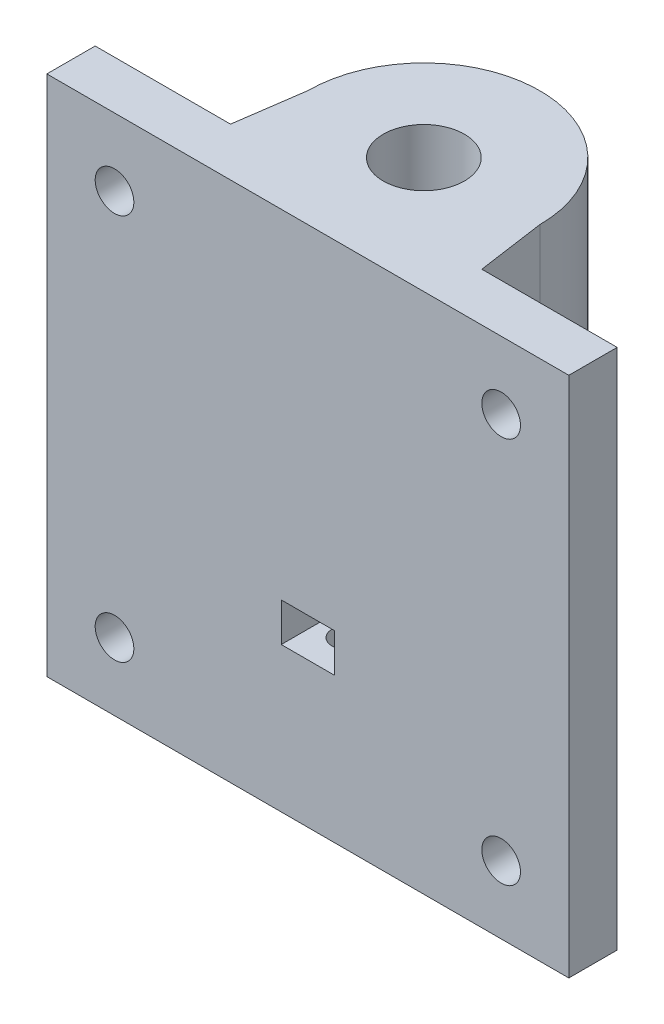
from build123d import *

# Parameters (mm, degrees)
SZKIC1_R                    = 12
SZKIC1_R_2                  = 4.2
DODANIE_WYCI_GNI_CIE1_DEPTH = 54
DODANIE_WYCI_GNI_CIE2_DEPTH = 54
SZKIC4_R                    = 1.5
WYTNIJ_WYCI_GNI_CIE1_DEPTH  = 20
SZYK_KO_OWY1_COUNT          = 4
WYTNIJ_WYCI_GNI_CIE2_START  = -7
SZKIC5_W                    = 5.5
SZKIC5_H                    = 4
WYTNIJ_WYCI_GNI_CIE2_DEPTH  = 10
SZYK_KO_OWY2_COUNT          = 4
SFAZOWANIE1_SIZE            = 1
SFAZOWANIE1_SIZE2           = 0.839099631
WYTNIJ_WYCI_GNI_CIE3_REACH  = 66.969
SZKIC6_R                    = 2


with BuildPart() as part:
    # Szkic1 → Dodanie-wyciągnięcie1 (new body)
    with BuildSketch(Plane(origin=(0, 0, 0), x_dir=(1, 0, 0), z_dir=(0, 1, 0))):
        with Locations(Location((0, 12, 0), (0, 0, 270))):
            Circle(SZKIC1_R)
        with Locations(Location((0, 12, 0), (0, 0, 270))):
            Circle(SZKIC1_R_2, mode=Mode.SUBTRACT)
    extrude(amount=DODANIE_WYCI_GNI_CIE1_DEPTH)

    # Szkic3 → Dodanie-wyciągnięcie2 (add)
    with BuildSketch(Plane(origin=(0, 0, 0), x_dir=(1, 0, 0), z_dir=(0, 1, 0))):
        Polygon((0, 0), (27, 0), (27, 5), (13, 5), (12, 12), (0, 5.166487606), (-12, 12), (-13, 5), (-27, 5), (-27, 0), align=None)
    extrude(amount=DODANIE_WYCI_GNI_CIE2_DEPTH)

    # Szkic4 → Wytnij-wyciągnięcie1 (cut)
    with BuildSketch(Plane(origin=(0, 0, 0), x_dir=(-1, 0, 0), z_dir=(0, -1, 0))):
        with Locations(Location((0, 20, 0), (0, 0, 90))):
            Circle(SZKIC4_R)
    wytnij_wyci_gni_cie1 = extrude(amount=-WYTNIJ_WYCI_GNI_CIE1_DEPTH, mode=Mode.SUBTRACT)

    # Szyk kołowy1: Wytnij-wyciągnięcie1 ×4 about axis
    szyk_ko_owy1_axis = Axis((0, 0, -12), (0, 1, 0))
    for i in range(1, SZYK_KO_OWY1_COUNT):
        add(wytnij_wyci_gni_cie1.rotate(szyk_ko_owy1_axis, i * 360 / SZYK_KO_OWY1_COUNT), mode=Mode.SUBTRACT)

    # Szkic5 → Wytnij-wyciągnięcie2 (cut)
    with BuildSketch(Plane.XY.offset(WYTNIJ_WYCI_GNI_CIE2_START)):
        with Locations((0, 17)):
            Rectangle(SZKIC5_W, SZKIC5_H)
    wytnij_wyci_gni_cie2 = extrude(amount=WYTNIJ_WYCI_GNI_CIE2_DEPTH, mode=Mode.SUBTRACT)

    # Szyk kołowy2: Wytnij-wyciągnięcie2 ×4 about axis
    szyk_ko_owy2_axis = Axis((0, 0, -12), (0, 1, 0))
    for i in range(1, SZYK_KO_OWY2_COUNT):
        add(wytnij_wyci_gni_cie2.rotate(szyk_ko_owy2_axis, i * 360 / SZYK_KO_OWY2_COUNT), mode=Mode.SUBTRACT)

    # Sfazowanie1
    sfazowanie1_edges = [part.edges().sort_by_distance(p)[0] for p in [
        (0, 0, -16.2),
    ]]
    sfazowanie1_side = [part.faces().sort_by_distance(p)[0] for p in [
        (0, 27, -16.2),
    ]]
    chamfer(sfazowanie1_edges, length=SFAZOWANIE1_SIZE, length2=SFAZOWANIE1_SIZE2, reference=sfazowanie1_side[0])

    # Szkic6 → Wytnij-wyciągnięcie3 (cut, up to next)
    with BuildSketch(Plane.XY, mode=Mode.PRIVATE) as wytnij_wyci_gni_cie3_sk1:
        with Locations((-20, 47)):
            Circle(SZKIC6_R)
    wytnij_wyci_gni_cie3_tool1 = extrude(wytnij_wyci_gni_cie3_sk1.sketch, amount=-WYTNIJ_WYCI_GNI_CIE3_REACH, mode=Mode.PRIVATE) & part.part
    # Szkic6 → Wytnij-wyciągnięcie3 (cut, up to next)
    with BuildSketch(Plane.XY, mode=Mode.PRIVATE) as wytnij_wyci_gni_cie3_sk2:
        with Locations((20, 47)):
            Circle(SZKIC6_R)
    wytnij_wyci_gni_cie3_tool2 = extrude(wytnij_wyci_gni_cie3_sk2.sketch, amount=-WYTNIJ_WYCI_GNI_CIE3_REACH, mode=Mode.PRIVATE) & part.part
    # Szkic6 → Wytnij-wyciągnięcie3 (cut, up to next)
    with BuildSketch(Plane.XY, mode=Mode.PRIVATE) as wytnij_wyci_gni_cie3_sk3:
        with Locations((20, 7)):
            Circle(SZKIC6_R)
    wytnij_wyci_gni_cie3_tool3 = extrude(wytnij_wyci_gni_cie3_sk3.sketch, amount=-WYTNIJ_WYCI_GNI_CIE3_REACH, mode=Mode.PRIVATE) & part.part
    # Szkic6 → Wytnij-wyciągnięcie3 (cut, up to next)
    with BuildSketch(Plane.XY, mode=Mode.PRIVATE) as wytnij_wyci_gni_cie3_sk4:
        with Locations((-20, 7)):
            Circle(SZKIC6_R)
    wytnij_wyci_gni_cie3_tool4 = extrude(wytnij_wyci_gni_cie3_sk4.sketch, amount=-WYTNIJ_WYCI_GNI_CIE3_REACH, mode=Mode.PRIVATE) & part.part
    add(wytnij_wyci_gni_cie3_tool1.solids().sort_by_distance((-20, 47, 0))[0], mode=Mode.SUBTRACT)
    add(wytnij_wyci_gni_cie3_tool2.solids().sort_by_distance((20, 47, 0))[0], mode=Mode.SUBTRACT)
    add(wytnij_wyci_gni_cie3_tool3.solids().sort_by_distance((20, 7, 0))[0], mode=Mode.SUBTRACT)
    add(wytnij_wyci_gni_cie3_tool4.solids().sort_by_distance((-20, 7, 0))[0], mode=Mode.SUBTRACT)


solid = part.part
